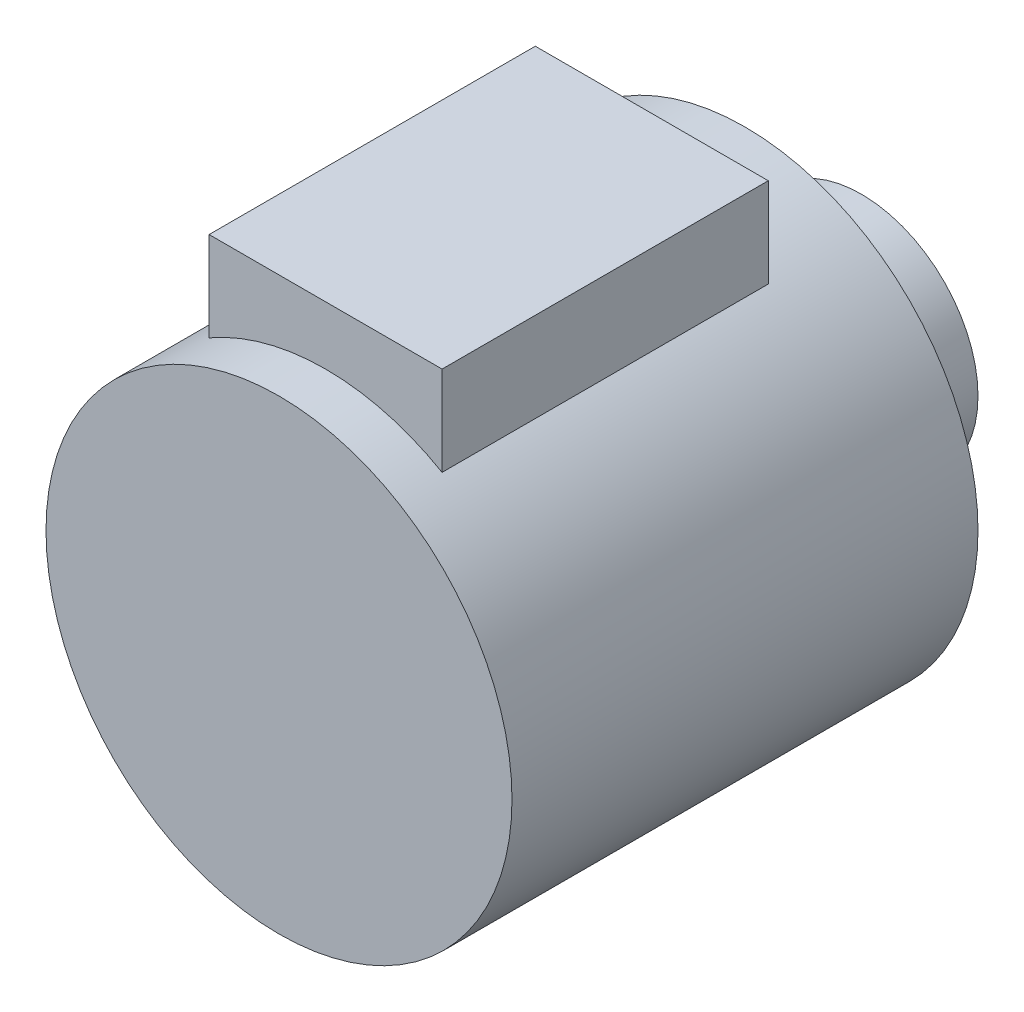
from build123d import *

# Parameters (mm, degrees)
SKETCH_1_R      = 10
EXTRUDE_1_DEPTH = 10
SKETCH_2_R      = 20
EXTRUDE_2_DEPTH = 40
SKETCH_3_W      = 20
SKETCH_3_H      = 28
EXTRUDE_3_DEPTH = 25


with BuildPart() as part:
    # 草图1 → 凸台-拉伸1 (new body)
    with BuildSketch(Plane.XY):
        Circle(SKETCH_1_R)
    extrude(amount=EXTRUDE_1_DEPTH)

    # 草图2 → 凸台-拉伸2 (add)
    with BuildSketch(Plane.XY.offset(10)):
        Circle(SKETCH_2_R)
    extrude(amount=EXTRUDE_2_DEPTH)

    # 草图3 → 凸台-拉伸3 (add)
    with BuildSketch(Plane(origin=(0, 0, 0), x_dir=(1, 0, 0), z_dir=(0, 1, 0))):
        with Locations((0, -32)):
            Rectangle(SKETCH_3_W, SKETCH_3_H)
    extrude(amount=EXTRUDE_3_DEPTH)


solid = part.part
